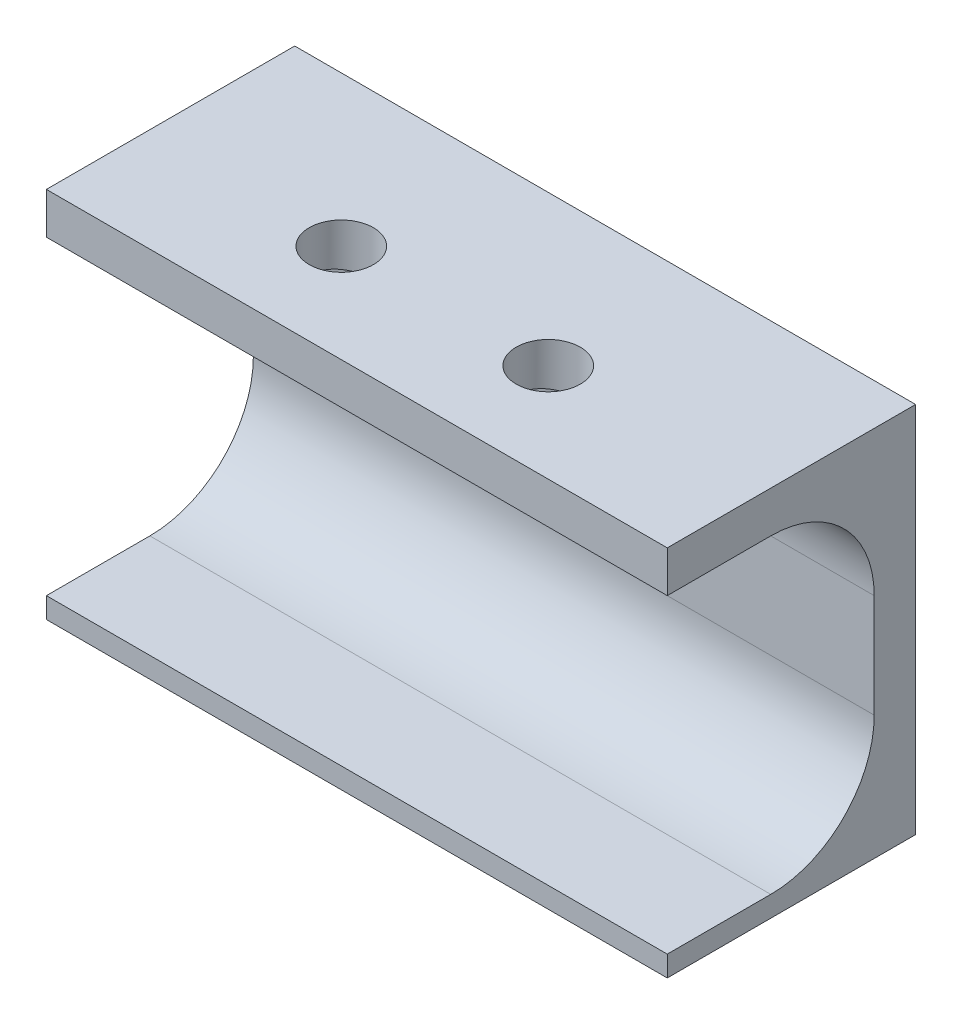
from build123d import *

# Parameters (mm, degrees)
BOSS_EXTRUDE1_DEPTH = 30
SKETCH2_R           = 1.55
CUT_EXTRUDE1_DEPTH  = 5


with BuildPart() as part:
    # Sketch1 → Boss-Extrude1 (new body)
    with BuildSketch(Plane(origin=(0, 0, 0), x_dir=(0, 0, -1), z_dir=(1, 0, 0))):
        with BuildLine():
            Line((-6.539148929, 14.609586507), (-11.539148929, 14.609586507))
            Line((-11.539148929, 14.609586507), (-11.539148929, 16.609586507))
            Line((-11.539148929, 16.609586507), (0.460851071, 16.609586507))
            Line((0.460851071, 16.609586507), (0.460851071, -1.390413493))
            Line((0.460851071, -1.390413493), (-11.539148929, -1.390413493))
            Line((-11.539148929, -1.390413493), (-11.539148929, -0.390413493))
            Line((-11.539148929, -0.390413493), (-8.539148929, -0.390413493))
            Line((-8.539148929, -0.390413493), (-6.539148929, -0.390413493))
            ThreePointArc((-6.539148929, -0.390413493), (-3.003615023, 1.074052601), (-1.539148929, 4.609586507))
            Line((-1.539148929, 4.609586507), (-1.539148929, 9.609586507))
            ThreePointArc((-1.539148929, 9.609586507), (-3.003615023, 13.145120413), (-6.539148929, 14.609586507))
        make_face()
    extrude(amount=BOSS_EXTRUDE1_DEPTH)

    # Sketch2 → Cut-Extrude1 (cut)
    with BuildSketch(Plane(origin=(0, 16.609586507, 0), x_dir=(1, 0, 0), z_dir=(0, 1, 0))):
        with Locations((-10.5, -6.789148929)):
            Circle(SKETCH2_R)
        with Locations((-20.5, -6.789148929)):
            Circle(SKETCH2_R)
        with Locations(Location((9.5, -6.789148929, 0), (0, 0, 270))):
            Circle(SKETCH2_R)
        with Locations(Location((19.5, -6.789148929, 0), (0, 0, 270))):
            Circle(SKETCH2_R)
    extrude(amount=-CUT_EXTRUDE1_DEPTH, mode=Mode.SUBTRACT)


solid = part.part
